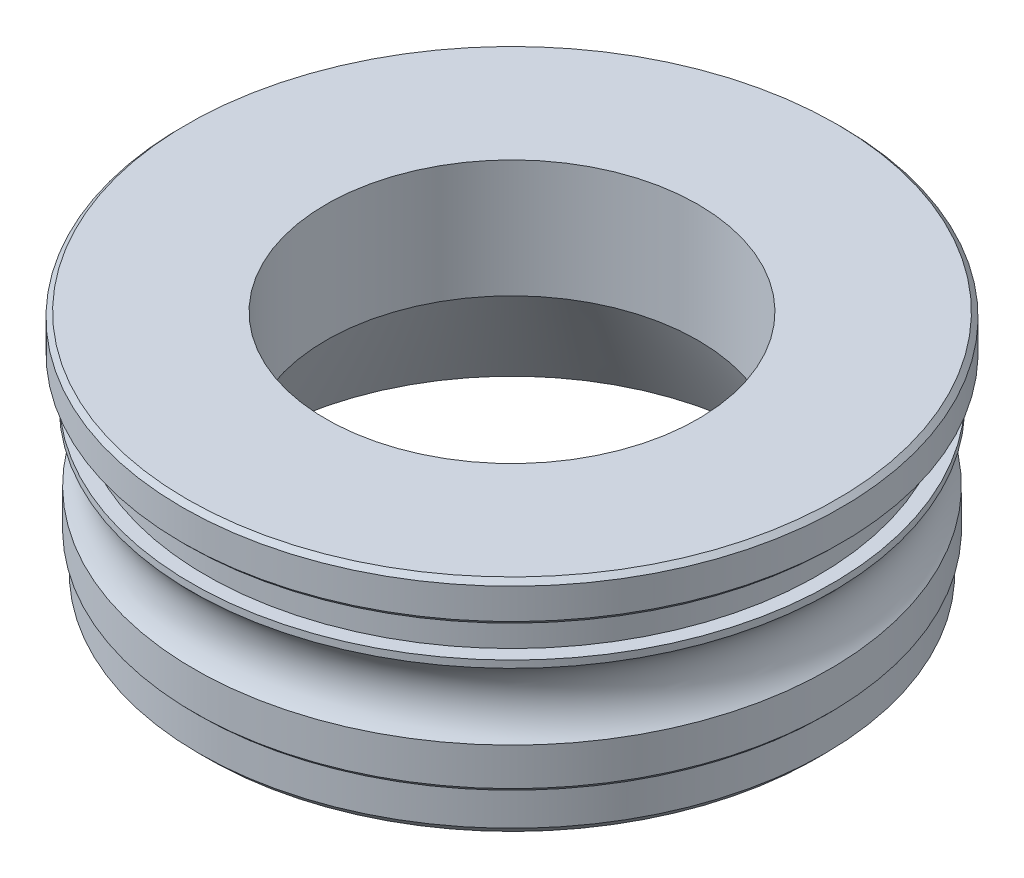
from build123d import *


with BuildPart() as part:
    # Croquis1 → Revolución1 (revolve)
    with BuildSketch(Plane.XY, mode=Mode.PRIVATE) as revoluci_n1_sk:
        with BuildLine():
            Line((6.45, 0), (6.65, 0.2))
            Line((6.65, 0.2), (6.65, 0.9))
            Line((6.65, 0.9), (6.75, 1))
            Line((6.75, 1), (6.75, 1.667))
            Line((6.75, 1.667), (6.75, 1.8))
            ThreePointArc((6.75, 1.8), (6.46467894, 2.534577468), (6.8, 3.247719775))
            Line((6.8, 3.247719775), (6.8, 3.4))
            Line((6.8, 3.4), (6.5, 3.4))
            Line((6.5, 3.4), (6.5, 4.15))
            Line((6.5, 4.15), (6.9, 4.15))
            Line((6.9, 4.15), (7, 4.25))
            Line((7, 4.25), (7, 4.9))
            Line((7, 4.9), (6.9, 5))
            Line((6.9, 5), (3.95, 5))
            Line((3.95, 5), (3.95, 2.5))
            Line((3.95, 2.5), (5.393375673, 0))
            Line((5.393375673, 0), (6.45, 0))
        make_face()
    revolve(revoluci_n1_sk.sketch.rotate(Axis((0, 0, 0), (0, 1, 0)), 90), axis=Axis((0, 0, 0), (0, 1, 0)))


solid = part.part
